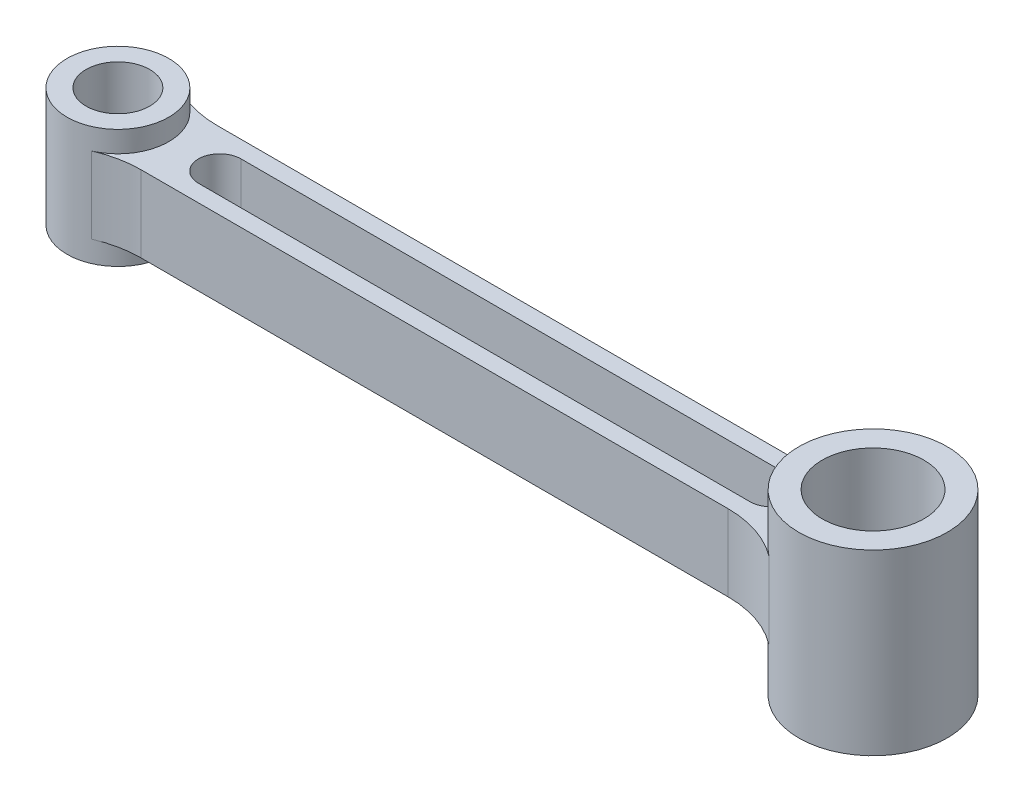
from build123d import *

# Parameters (mm, degrees)
SKETCH1_R           = 7.5
BOSS_EXTRUDE1_DEPTH = 14
SKETCH1_6_R         = 12
BOSS_EXTRUDE2_DEPTH = 21
BOSS_EXTRUDE3_DEPTH = 9
CUT_EXTRUDE1_REACH  = 114.02


with BuildPart() as part:
    # Sketch1 → Boss-Extrude1 (new, symmetric)
    with BuildSketch(Plane(origin=(0, 0, 0), x_dir=(1, 0, 0), z_dir=(0, 1, 0))):
        with BuildLine():
            ThreePointArc((-77, 0), (-78.96132533, 6.574573055), (-84.204168477, 11))
            ThreePointArc((-84.204168477, 11), (-101, 0), (-84.204168477, -11))
            ThreePointArc((-84.204168477, -11), (-78.96132533, -6.574573055), (-77, 0))
        make_face()
        with Locations((-89, 0)):
            Circle(SKETCH1_R, mode=Mode.SUBTRACT)
    extrude(amount=BOSS_EXTRUDE1_DEPTH, both=True)



with BuildPart() as body_2:
    # Sketch1<6> → Boss-Extrude2 (new, symmetric)
    with BuildSketch(Plane(origin=(0, 0, 0), x_dir=(1, 0, 0), z_dir=(0, 1, 0))):
        with BuildLine():
            ThreePointArc((106.5, 0), (96.76364668, 15.683615343), (78.388481117, 13.915662651))
            ThreePointArc((78.388481117, 13.915662651), (71.5, 0), (78.388481117, -13.915662651))
            ThreePointArc((78.388481117, -13.915662651), (96.76364668, -15.683615343), (106.5, 0))
        make_face()
        with Locations((89, 0)):
            Circle(SKETCH1_6_R, mode=Mode.SUBTRACT)
    extrude(amount=BOSS_EXTRUDE2_DEPTH, both=True)


with BuildPart() as part_1:
    add(part.part)

    add(body_2.part)  # Boss-Extrude3 merges body 2
    # Sketch1<7> → Boss-Extrude3 (add, symmetric)
    with BuildSketch(Plane(origin=(0, 0, 0), x_dir=(1, 0, 0), z_dir=(0, 1, 0))):
        with BuildLine():
            ThreePointArc((-84.204168477, 11), (-77, 0), (-84.204168477, -11))
            ThreePointArc((-84.204168477, -11), (-79.511484916, -9.505319751), (-74.61250543, -9))
            Line((-74.61250543, -9), (63.835540936, -9))
            ThreePointArc((63.835540936, -9), (71.515902373, -10.26210106), (78.388481117, -13.915662651))
            ThreePointArc((78.388481117, -13.915662651), (71.5, 0), (78.388481117, 13.915662651))
            ThreePointArc((78.388481117, 13.915662651), (71.515902373, 10.26210106), (63.835540936, 9))
            Line((63.835540936, 9), (-74.61250543, 9))
            ThreePointArc((-74.61250543, 9), (-79.511484916, 9.505319751), (-84.204168477, 11))
        make_face()
    extrude(amount=BOSS_EXTRUDE3_DEPTH, both=True)

    # Sketch2 → Cut-Extrude1 (cut, up to next)
    with BuildSketch(Plane(origin=(0, 9, 0), x_dir=(1, 0, 0), z_dir=(0, 1, 0)), mode=Mode.PRIVATE) as cut_extrude1_sk1:
        with BuildLine():
            Line((-65, 5), (65, 5))
            ThreePointArc((65, 5), (70, 0), (65, -5))
            Line((65, -5), (-65, -5))
            ThreePointArc((-65, -5), (-70, 0), (-65, 5))
        make_face()
    cut_extrude1_tool1 = extrude(cut_extrude1_sk1.sketch, amount=-CUT_EXTRUDE1_REACH, mode=Mode.PRIVATE) & part_1.part
    add(cut_extrude1_tool1.solids().sort_by_distance((0, 9, 0))[0], mode=Mode.SUBTRACT)


solid = part_1.part
